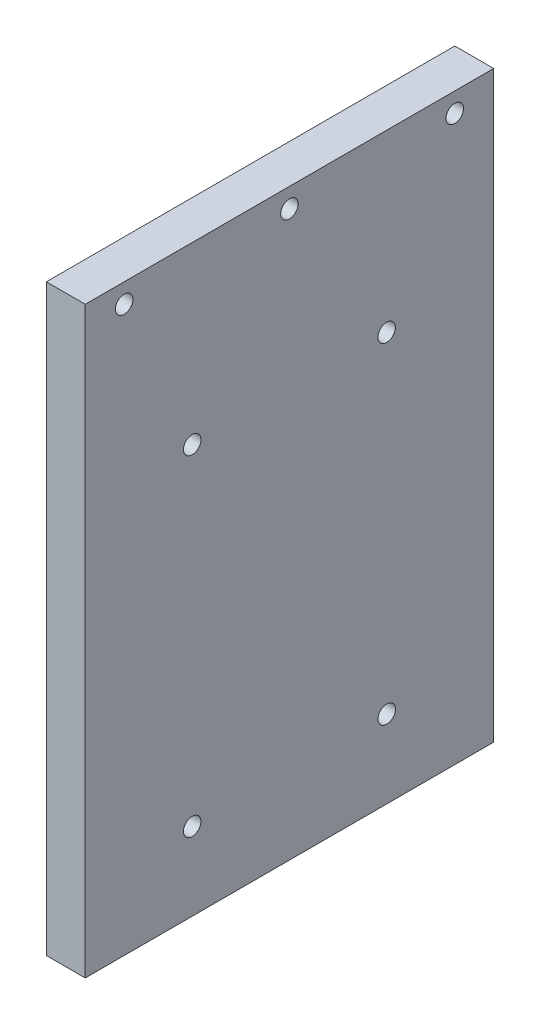
from build123d import *

# Parameters (mm, degrees)
CROQUIS1_W              = 105
CROQUIS1_H              = 150
SALIENTE_EXTRUIR1_DEPTH = 10
CROQUIS2_R              = 2.25
CORTAR_EXTRUIR1_DEPTH   = 93.093702282
CROQUIS3_R              = 2.25
CORTAR_EXTRUIR2_DEPTH   = 93.093702282


with BuildPart() as part:
    # Croquis1 → Saliente-Extruir1 (new body)
    with BuildSketch(Plane(origin=(0, 0, 0), x_dir=(0, 0, -1), z_dir=(1, 0, 0))):
        Rectangle(CROQUIS1_W, CROQUIS1_H)
    extrude(amount=SALIENTE_EXTRUIR1_DEPTH)

    # Croquis2 → Cortar-Extruir1 (cut, through all)
    with BuildSketch(Plane(origin=(10, 0, 0), x_dir=(0, 0, -1), z_dir=(1, 0, 0))):
        with Locations((-42.5, 70)):
            Circle(CROQUIS2_R)
        with Locations((0, 70)):
            Circle(CROQUIS2_R)
        with Locations((42.5, 70)):
            Circle(CROQUIS2_R)
    extrude(amount=-CORTAR_EXTRUIR1_DEPTH, mode=Mode.SUBTRACT)

    # Croquis3 → Cortar-Extruir2 (cut, through all)
    with BuildSketch(Plane(origin=(10, 0, 0), x_dir=(0, 0, -1), z_dir=(1, 0, 0))):
        with Locations((25, 30)):
            Circle(CROQUIS3_R)
        with Locations((-25, 30)):
            Circle(CROQUIS3_R)
        with Locations((25, -55)):
            Circle(CROQUIS3_R)
        with Locations((-25, -55)):
            Circle(CROQUIS3_R)
    extrude(amount=-CORTAR_EXTRUIR2_DEPTH, mode=Mode.SUBTRACT)


solid = part.part
